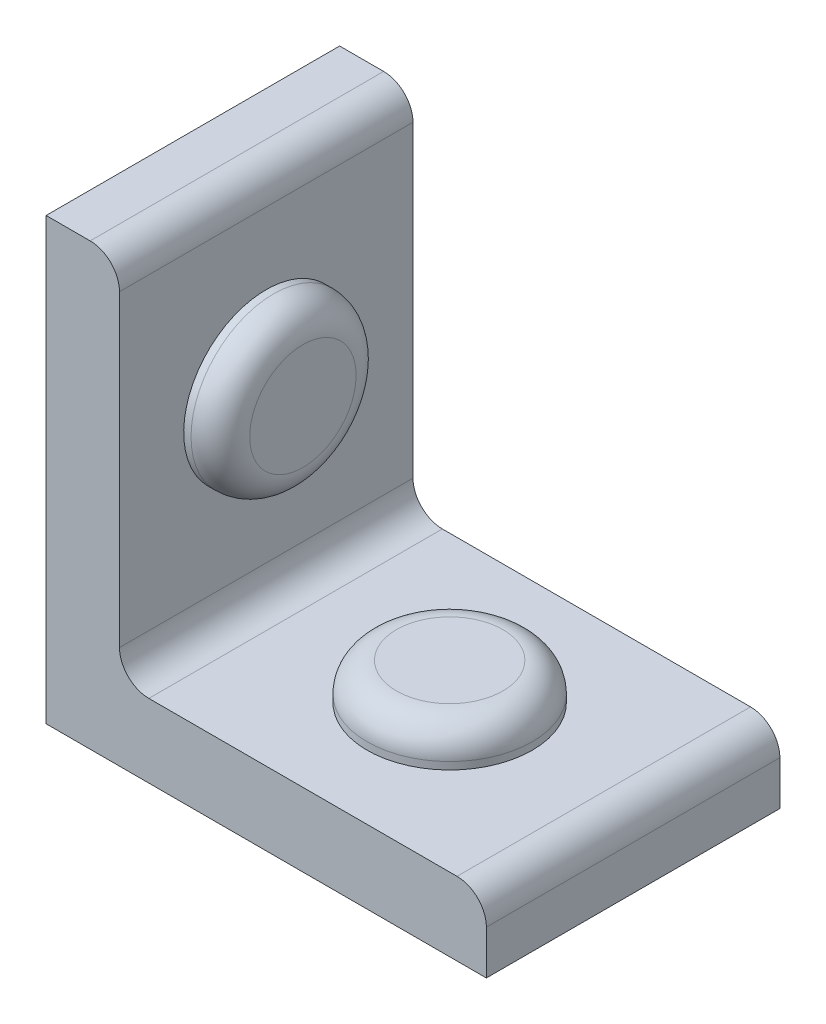
from build123d import *

# Parameters (mm, degrees)
BOSS_EXTRUDE1_DEPTH = 25.4
SKETCH2_R           = 7.14375
BOSS_EXTRUDE2_DEPTH = 3.175
FILLET1_R           = 2.54
SKETCH3_R           = 7.14375
BOSS_EXTRUDE3_DEPTH = 3.175
FILLET2_R           = 2.54


with BuildPart() as part:
    # Sketch1 → Boss-Extrude1 (new body)
    with BuildSketch(Plane.XY):
        with BuildLine():
            Line((0, 0), (38.1, 0))
            Line((38.1, 0), (38.1, 3.81))
            ThreePointArc((38.1, 3.81), (37.356051224, 5.606051224), (35.56, 6.35))
            Line((35.56, 6.35), (8.89, 6.35))
            ThreePointArc((8.89, 6.35), (7.093948776, 7.093948776), (6.35, 8.89))
            Line((6.35, 8.89), (6.35, 35.56))
            ThreePointArc((6.35, 35.56), (5.606051224, 37.356051224), (3.81, 38.1))
            Line((3.81, 38.1), (0, 38.1))
            Line((0, 38.1), (0, 0))
        make_face()
    extrude(amount=BOSS_EXTRUDE1_DEPTH)

    # Sketch2 → Boss-Extrude2 (add)
    with BuildSketch(Plane(origin=(0, 6.35, 0), x_dir=(1, 0, 0), z_dir=(0, 1, 0))):
        with Locations((22.225, -12.7)):
            Circle(SKETCH2_R)
    extrude(amount=BOSS_EXTRUDE2_DEPTH)

    # Fillet1
    fillet1_edges = [part.edges().sort_by_distance(p)[0] for p in [
        (15.08125, 9.525, 12.7),
    ]]
    fillet(fillet1_edges, radius=FILLET1_R)

    # Sketch3 → Boss-Extrude3 (add)
    with BuildSketch(Plane(origin=(6.35, 0, 0), x_dir=(0, 0, -1), z_dir=(1, 0, 0))):
        with Locations(Location((-12.7, 22.225, 0), (0, 0, 270))):
            Circle(SKETCH3_R)
    extrude(amount=BOSS_EXTRUDE3_DEPTH)

    # Fillet2
    fillet2_edges = [part.edges().sort_by_distance(p)[0] for p in [
        (9.525, 29.36875, 12.7),
    ]]
    fillet(fillet2_edges, radius=FILLET2_R)


solid = part.part
